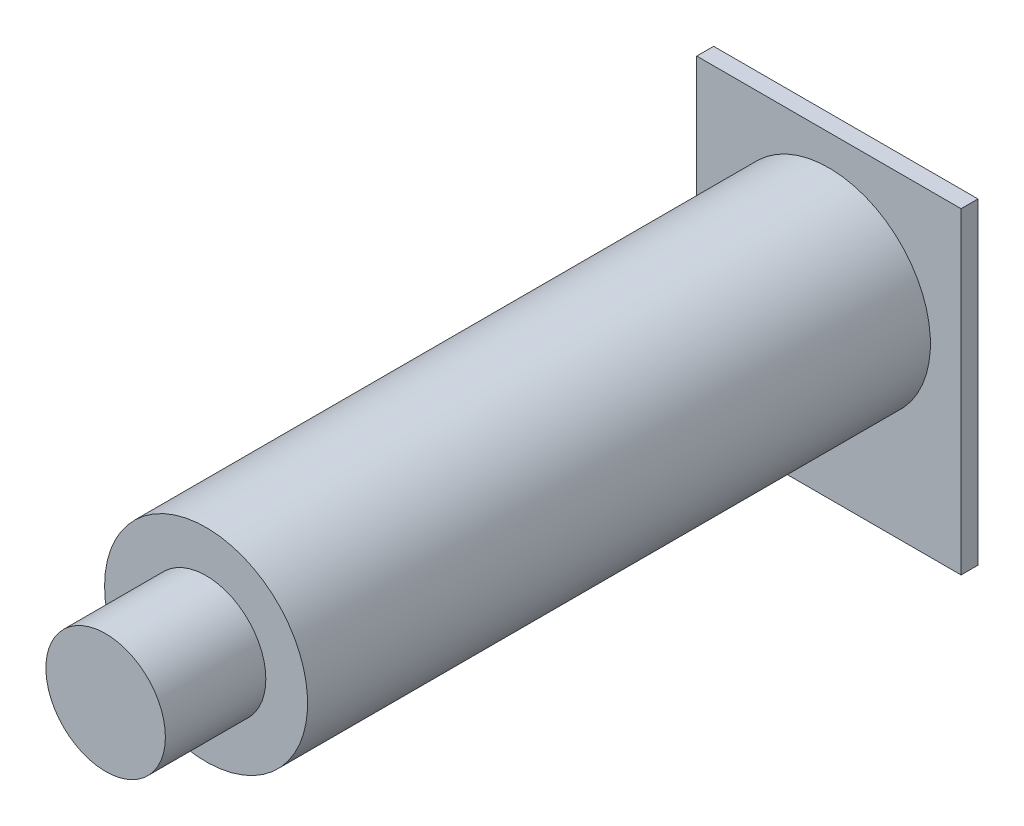
from build123d import *

# Parameters (mm, degrees)
SKETCH_1_W      = 25
SKETCH_1_H      = 30
EXTRUDE_1_DEPTH = 1.6
SKETCH_2_R      = 9.6
EXTRUDE_2_DEPTH = 58.9
SKETCH_4_R      = 5.65
EXTRUDE_3_DEPTH = 9.5


with BuildPart() as part:
    # ｽｹｯﾁ1 → ﾎﾞｽ - 押し出し1 (new body)
    with BuildSketch(Plane.XY):
        with Locations((-14.765846009, 19.364285714)):
            Rectangle(SKETCH_1_W, SKETCH_1_H)
    extrude(amount=EXTRUDE_1_DEPTH)

    # ｽｹｯﾁ2 → ﾎﾞｽ - 押し出し2 (add)
    with BuildSketch(Plane.XY.offset(1.6)):
        with Locations(Location((-14.765846009, 21.864285714, 0), (0, 0, 180))):
            Circle(SKETCH_2_R)
    extrude(amount=EXTRUDE_2_DEPTH)

    # ｽｹｯﾁ4 → ﾎﾞｽ - 押し出し3 (add)
    with BuildSketch(Plane.XY.offset(60.5)):
        with Locations((-14.765846009, 21.864285714)):
            Circle(SKETCH_4_R)
    extrude(amount=EXTRUDE_3_DEPTH)


solid = part.part
